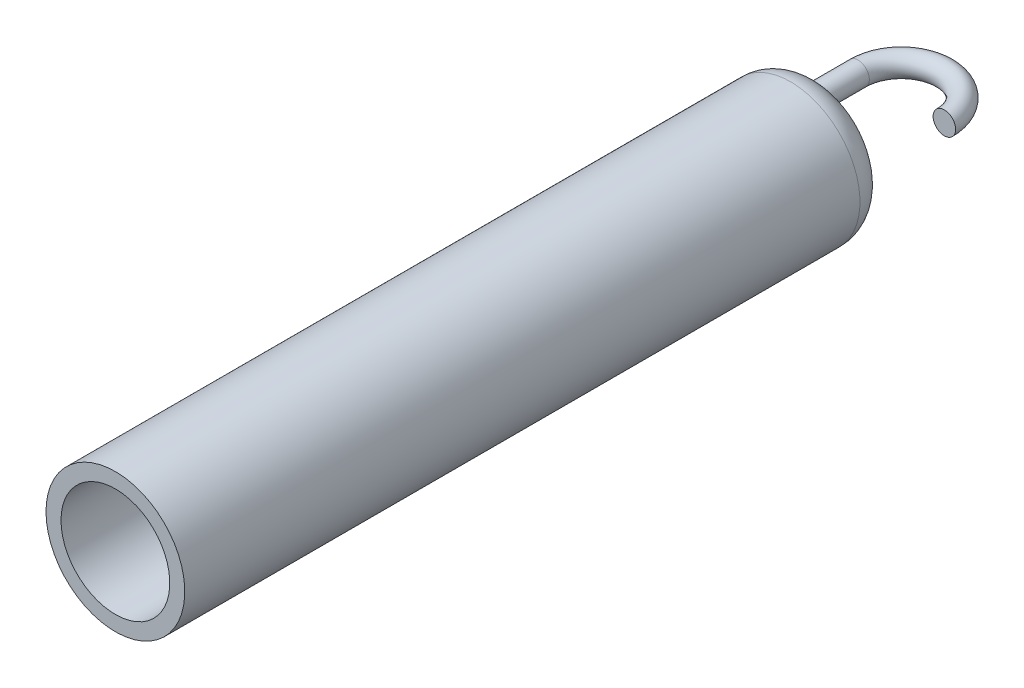
from build123d import *

# Parameters (mm, degrees)
ESQUISSE2_R        = 9.25
ESQUISSE2_R_2      = 7.25
BOSS_EXTRU_1_DEPTH = 45
ESQUISSE5_R        = 1.5


with BuildPart() as part:
    # Esquisse2 → Boss.-Extru.1 (new, symmetric)
    with BuildSketch(Plane.XY):
        with Locations(Location((0, 0, 0), (0, 0, 180))):
            Circle(ESQUISSE2_R)
        with Locations(Location((0, 0, 0), (0, 0, 180))):
            Circle(ESQUISSE2_R_2, mode=Mode.SUBTRACT)
    extrude(amount=BOSS_EXTRU_1_DEPTH, both=True)

    # Esquisse3 → Révolution1 (revolve)
    with BuildSketch(Plane(origin=(0, 0, 0), x_dir=(1, 0, 0), z_dir=(0, 1, 0))):
        with BuildLine():
            Line((-5.25, 49), (0, 49))
            Line((0, 49), (0, 45))
            Line((0, 45), (-9.25, 45))
            ThreePointArc((-9.25, 45), (-8.078427125, 47.828427125), (-5.25, 49))
        make_face()
    revolve(axis=Axis((0, 0, -49), (0, 0, 1)))

    # Balayage3: sweep along a path in Esquisse6
    with BuildLine(Plane(origin=(0, 0, 0), x_dir=(1, 0, 0), z_dir=(0, 1, 0))) as balayage3_path:
        Line((-4.25, 45), (-4.25, 59.75))
        ThreePointArc((-4.25, 59.75), (0, 64), (4.25, 59.75))
    # Esquisse5 → Balayage3 (sweep)
    with BuildSketch(Plane(origin=(0, 0, 0), x_dir=(0, 0, -1), z_dir=(1, 0, 0))):
        with Locations((65.5, 0)):
            Circle(ESQUISSE5_R)
    sweep(path=balayage3_path.line)


solid = part.part
